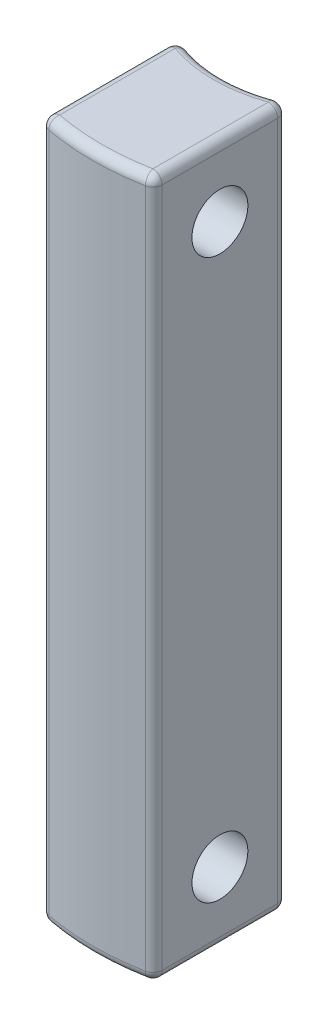
from build123d import *

# Parameters (mm, degrees)
EXTRUDE_1_DEPTH     = 75
FILLET_1_R          = 1
SKETCH_2_R          = 3
CUT_EXTRUDE_1_DEPTH = 81.950602221


with BuildPart() as part:
    # 草图1 → 凸台-拉伸1 (new body)
    with BuildSketch(Plane(origin=(0, 0, 0), x_dir=(1, 0, 0), z_dir=(0, 1, 0))):
        with BuildLine():
            Line((6, -14.142135624), (6, -26.532998323))
            ThreePointArc((6, -26.532998323), (5.769800359, -27.171283061), (5.185185185, -27.515701964))
            ThreePointArc((5.185185185, -27.515701964), (0, -28), (-5.185185185, -27.515701964))
            ThreePointArc((-5.185185185, -27.515701964), (-5.769800359, -27.171283061), (-6, -26.532998323))
            Line((-6, -26.532998323), (-6, -14.142135624))
            ThreePointArc((-6, -14.142135624), (-5.577350269, -13.325639043), (-4.666666667, -13.199326582))
            ThreePointArc((-4.666666667, -13.199326582), (0, -14), (4.666666667, -13.199326582))
            ThreePointArc((4.666666667, -13.199326582), (5.577350269, -13.325639043), (6, -14.142135624))
        make_face()
    extrude(amount=EXTRUDE_1_DEPTH)

    # 圆角1
    fillet_1_edges = [part.edges().sort_by_distance(p)[0] for p in [
        (6, 0, 20.337566973),
        (5.769800359, 0, 27.171283061),
        (0, 0, 28),
        (-5.769800359, 0, 27.171283061),
        (5.769800359, 75, 27.171283061),
        (6, 75, 20.337566973),
        (5.577350269, 75, 13.325639043),
        (0, 75, 14),
        (-5.577350269, 75, 13.325639043),
        (-6, 75, 20.337566973),
        (-5.769800359, 75, 27.171283061),
        (-6, 0, 20.337566973),
        (0, 75, 28),
        (-5.577350269, 0, 13.325639043),
        (0, 0, 14),
        (5.577350269, 0, 13.325639043),
    ]]
    fillet(fillet_1_edges, radius=FILLET_1_R)

    # 草图2 → 切除-拉伸1 (cut, through all)
    with BuildSketch(Plane(origin=(6, 0, 0), x_dir=(0, 0, -1), z_dir=(1, 0, 0))):
        with Locations((-20.337566973, 7.5)):
            Circle(SKETCH_2_R)
        with Locations(Location((-20.337566973, 67.5, 0), (0, 0, 180))):
            Circle(SKETCH_2_R)
    extrude(amount=-CUT_EXTRUDE_1_DEPTH, mode=Mode.SUBTRACT)


solid = part.part
